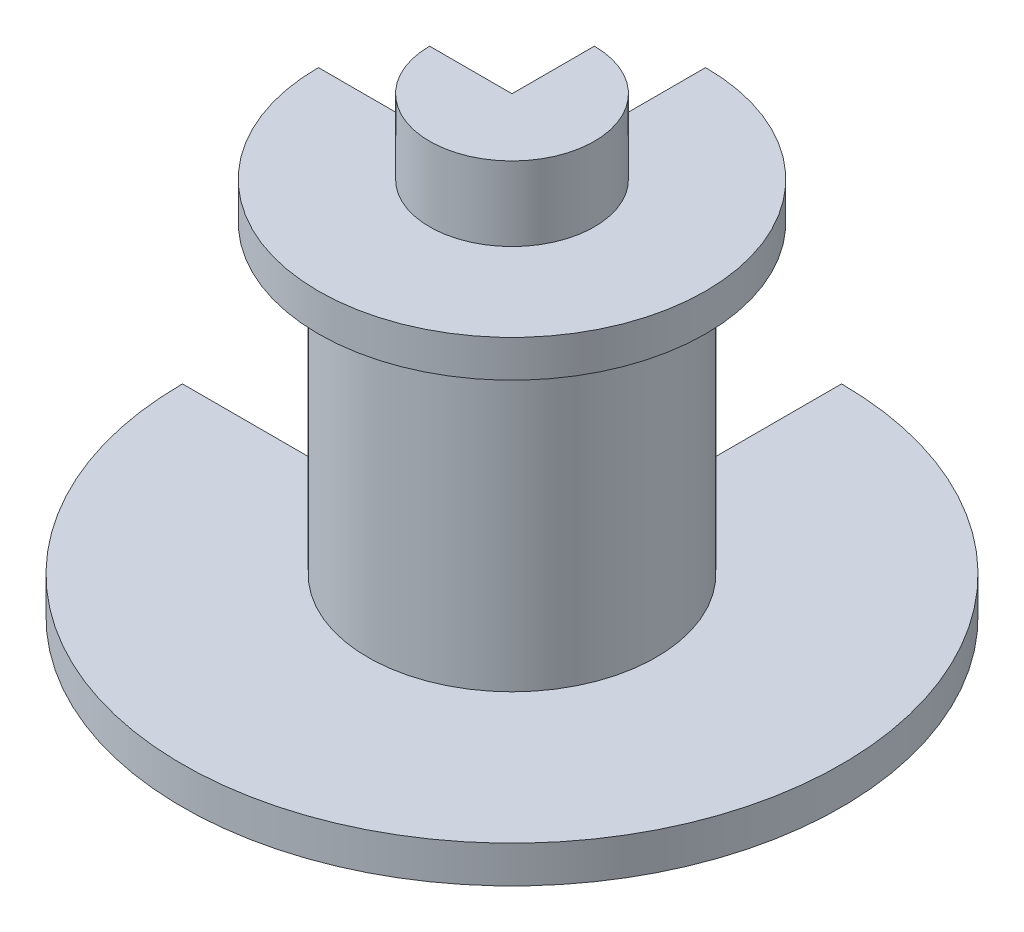
from build123d import *

# Parameters (mm, degrees)
REVOLVE1_ANGLE = 270


with BuildPart() as part:
    # Sketch1 → Revolve1 (revolve)
    with BuildSketch(Plane.XY):
        Polygon((0, 0), (-80, 0), (-80, 9), (-35, 9), (-35, 83), (-47, 83), (-47, 92), (-20, 92), (-20, 110), (0, 110), align=None)
    revolve(axis=Axis((0, 0, 0), (0, 1, 0)), revolution_arc=REVOLVE1_ANGLE)


solid = part.part
